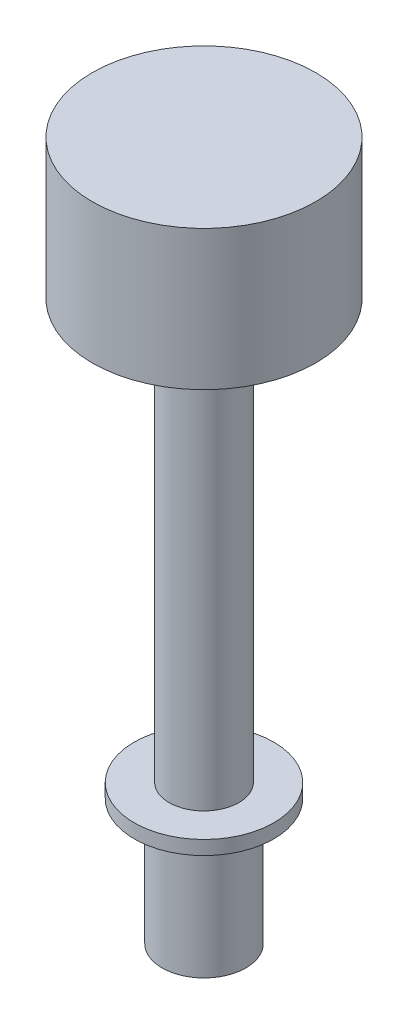
from build123d import *


with BuildPart() as part:
    # Sketch1 → Revolve1 (revolve)
    with BuildSketch(Plane.XY, mode=Mode.PRIVATE) as revolve1_sk:
        Polygon((0, -10), (0, 40), (-8, 40), (-8, 30), (-2.5, 30), (-2.5, 0), (-5, 0), (-5, -1), (-3, -1), (-3, -10), align=None)
    revolve(revolve1_sk.sketch.rotate(Axis((0, -10, 0), (0, 1, 0)), 270), axis=Axis((0, -10, 0), (0, 1, 0)))


solid = part.part
